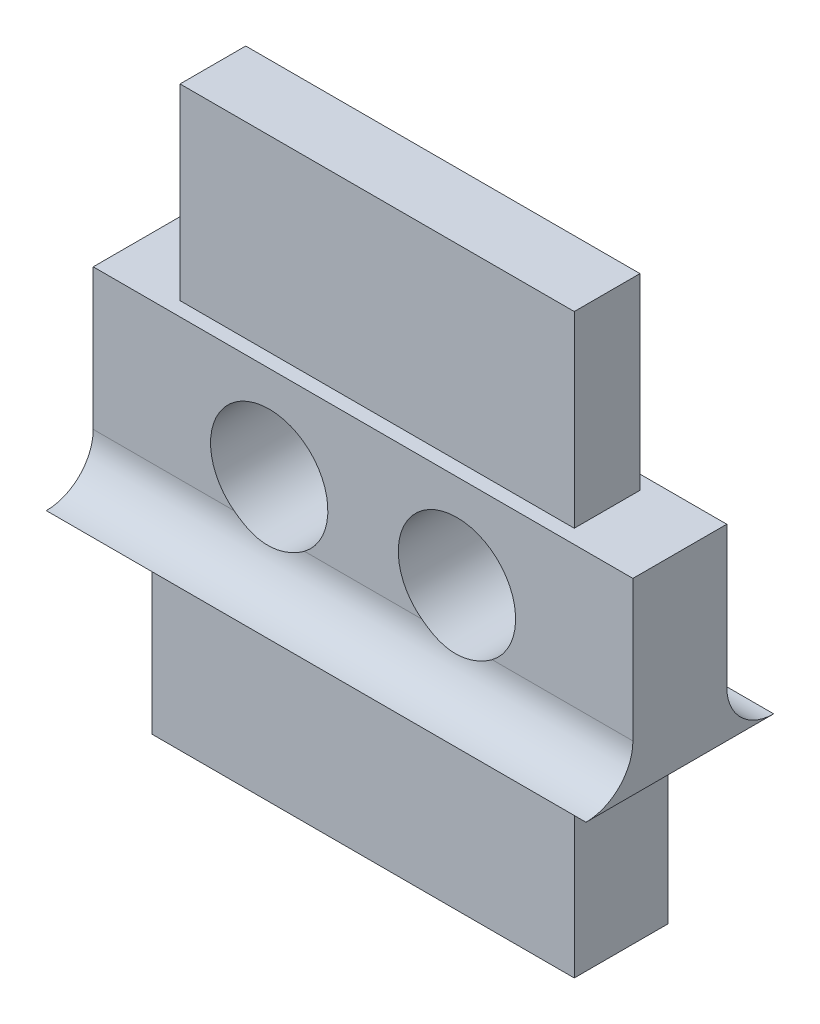
from build123d import *
from build123d.topology import SkipClean

# Parameters (mm, degrees)
MODEL_R                 = 1.25
BOSS_EXTRUDE1_DEPTH     = 2
BOSS_EXTRUDE2_REACH     = 18.741
CUT_EXTRUDE1_DEPTH      = 17.889836012
CUT_EXTRUDE1_DEPTH_BACK = 17.889836012
SKETCH2_R               = 1.25
SKETCH3_W               = 9.00072
SKETCH3_H               = 2
SKETCH3_W_2             = 8.40072
SKETCH3_H_2             = 1.4
CUT_EXTRUDE2_DEPTH      = 4


with BuildPart() as part:
    # Model → Boss-Extrude1 (new body)
    with BuildSketch(Plane.XY):
        Polygon((1.25, 4), (0, 4), (0, 8), (1.25, 8), (1.25, 12), (10.25072, 12), (10.25072, 8), (11.50072, 8), (11.50072, 4), (10.25072, 4), (10.25072, 0), (1.25, 0), align=None)
        with Locations((7.75072, 6)):
            Circle(MODEL_R, mode=Mode.SUBTRACT)
        with Locations((3.75, 6)):
            Circle(MODEL_R, mode=Mode.SUBTRACT)
    extrude(amount=BOSS_EXTRUDE1_DEPTH)

    # Boss-Extrude2: up to this face of the body (flat: up to its plane)
    boss_extrude2_end = Plane(part.part.faces().sort_by_distance((11.50072, 6, 1))[0])
    # Sketch1 → Boss-Extrude2 (add, up to the picked face)
    with BuildSketch(Plane.ZY, mode=Mode.PRIVATE) as boss_extrude2_sk1:
        with BuildLine():
            Line((2, 4), (2, 5))
            ThreePointArc((2, 5), (2.292893219, 4.292893219), (3, 4))
            Line((3, 4), (2, 4))
        make_face()
    boss_extrude2_tool1 = split(extrude(boss_extrude2_sk1.sketch, amount=-BOSS_EXTRUDE2_REACH, mode=Mode.PRIVATE), bisect_by=boss_extrude2_end, keep=Keep.BOTH, mode=Mode.PRIVATE)
    # Sketch1 → Boss-Extrude2 (add, up to the picked face)
    with BuildSketch(Plane.ZY, mode=Mode.PRIVATE) as boss_extrude2_sk2:
        with BuildLine():
            Line((0, 4), (-1, 4))
            ThreePointArc((-1, 4), (-0.292893219, 4.292893219), (0, 5))
            Line((0, 5), (0, 4))
        make_face()
    boss_extrude2_tool2 = split(extrude(boss_extrude2_sk2.sketch, amount=-BOSS_EXTRUDE2_REACH, mode=Mode.PRIVATE), bisect_by=boss_extrude2_end, keep=Keep.BOTH, mode=Mode.PRIVATE)
    add(boss_extrude2_tool1.solids().sort_by(Axis((0, 4.223368, 2.223368), (1, 0, 0)))[0])
    add(boss_extrude2_tool2.solids().sort_by(Axis((0, 4.223368, -0.223368), (1, 0, 0)))[0])

    # Sketch2 → Cut-Extrude1 (cut, two sides: drawn at the far end of the back side and taken through both)
    with SkipClean():  # the faces are left unmerged after this step: merging them gives an invalid solid
        with BuildSketch(Plane.XY.offset(2).offset(-CUT_EXTRUDE1_DEPTH_BACK)):
            with Locations(Location((3.75, 6, 0), (0, 0, 233.130102354))):
                Circle(SKETCH2_R)
            with Locations(Location((7.75072, 6, 0), (0, 0, 233.130102356))):
                Circle(SKETCH2_R)
        extrude(amount=CUT_EXTRUDE1_DEPTH + CUT_EXTRUDE1_DEPTH_BACK, mode=Mode.SUBTRACT)

    # Sketch3 → Cut-Extrude2 (cut)
    with SkipClean():  # the faces are left unmerged after this step: merging them gives an invalid solid
        with BuildSketch(Plane(origin=(0, 12, 0), x_dir=(1, 0, 0), z_dir=(0, 1, 0))):
            with Locations((5.75036, -1)):
                Rectangle(SKETCH3_W, SKETCH3_H)
            with Locations((5.75036, -1)):
                Rectangle(SKETCH3_W_2, SKETCH3_H_2, mode=Mode.SUBTRACT)
        extrude(amount=-CUT_EXTRUDE2_DEPTH, mode=Mode.SUBTRACT)


solid = part.part
